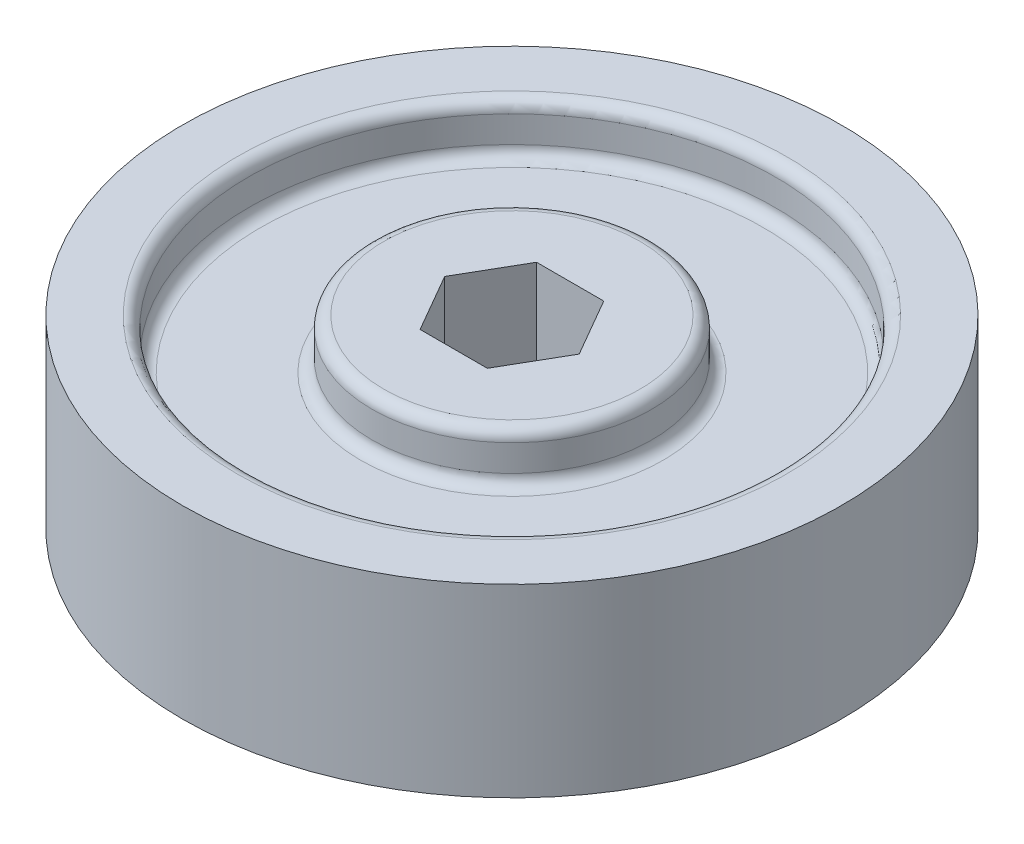
from build123d import *

# Parameters (mm, degrees)
SKETCH1_R           = 35.941
BOSS_EXTRUDE1_DEPTH = 20.1676
SKETCH2_R           = 28.702
SKETCH2_R_2         = 15.24
CUT_EXTRUDE1_DEPTH  = 5.4356
CUT_EXTRUDE2_START  = -5.4356
SKETCH3_R           = 28.702
SKETCH3_R_2         = 15.24
CUT_EXTRUDE2_DEPTH  = 5.4356
FILLET2_R           = 1.27


with BuildPart() as part:
    # Sketch1 → Boss-Extrude1 (new body)
    with BuildSketch(Plane(origin=(0, 0, 0), x_dir=(1, 0, 0), z_dir=(0, 1, 0))):
        with Locations(Location((0, 0, 0), (0, 0, 270))):
            Circle(SKETCH1_R)
        Polygon((3.666174209, -6.35), (7.332348419, 0), (3.666174209, 6.35), (-3.666174209, 6.35), (-7.332348419, 0), (-3.666174209, -6.35), align=None, mode=Mode.SUBTRACT)
    extrude(amount=BOSS_EXTRUDE1_DEPTH)

    # Sketch2 → Cut-Extrude1 (cut)
    with BuildSketch(Plane(origin=(0, 20.1676, 0), x_dir=(1, 0, 0), z_dir=(0, 1, 0))):
        with Locations(Location((0, 0, 0), (0, 0, 270))):
            Circle(SKETCH2_R)
        with Locations(Location((0, 0, 0), (0, 0, 270))):
            Circle(SKETCH2_R_2, mode=Mode.SUBTRACT)
    extrude(amount=-CUT_EXTRUDE1_DEPTH, mode=Mode.SUBTRACT)

    # Sketch3 → Cut-Extrude2 (cut)
    with BuildSketch(Plane.XZ.offset(CUT_EXTRUDE2_START)):
        with Locations(Location((0, 0, 0), (0, 0, 90))):
            Circle(SKETCH3_R)
        with Locations(Location((0, 0, 0), (0, 0, 90))):
            Circle(SKETCH3_R_2, mode=Mode.SUBTRACT)
    extrude(amount=CUT_EXTRUDE2_DEPTH, mode=Mode.SUBTRACT)

    # Fillet2
    fillet2_edges = [part.edges().sort_by_distance(p)[0] for p in [
        (0, 14.732, -28.702),
        (0, 14.732, -15.24),
        (0, 20.1676, -28.702),
        (0, 20.1676, -15.24),
        (0, 5.4356, -28.702),
        (0, 5.4356, -15.24),
        (0, 0, -28.702),
        (0, 0, -15.24),
    ]]
    fillet(fillet2_edges, radius=FILLET2_R)


solid = part.part
